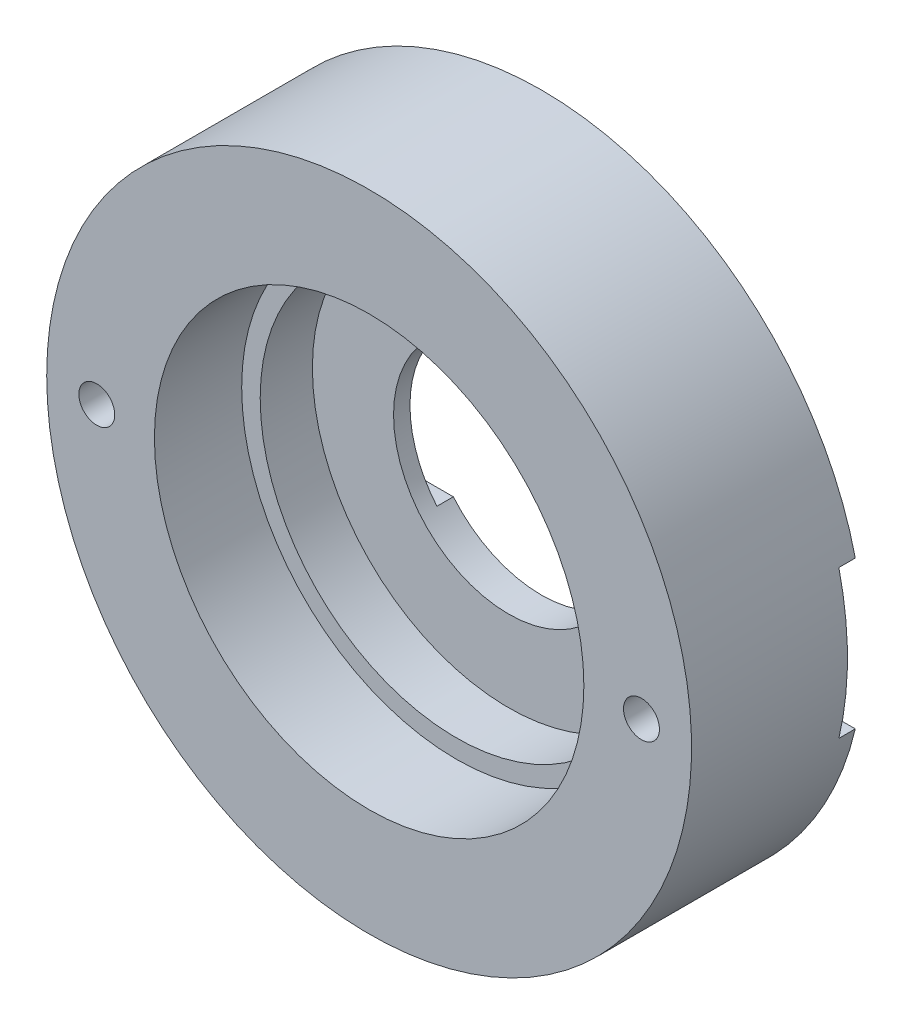
from build123d import *

# Parameters (mm, degrees)
SKETCH1_W          = 12.617819502
SKETCH1_H          = 2
SKETCH1_W_2        = 6.5532
SKETCH1_H_2        = 5.31
SKETCH2_R          = 1.0922
CUT_EXTRUDE1_DEPTH = 30.658943154
SKETCH3_W          = 45.123892984
SKETCH3_H          = 9
CUT_EXTRUDE2_DEPTH = 1


with BuildPart() as part:
    # Sketch1 → Revolve1 (revolve)
    with BuildSketch(Plane(origin=(0, 0, 0), x_dir=(1, 0, 0), z_dir=(0, 1, 0))):
        with Locations((-13.308909751, 3.700473465)):
            Rectangle(SKETCH1_W, SKETCH1_H)
        Polygon((-11.938, 2.700473465), (-19.617819502, 2.700473465), (-19.617819502, -0.474526535), (-13.064619502, -0.474526535), (-11.938, -0.474526535), align=None)
        with Locations((-16.341219502, -3.129526535)):
            Rectangle(SKETCH1_W_2, SKETCH1_H_2)
    revolve(axis=Axis((0, 0, -25.411285606), (0, 0, 1)))

    # Sketch2 → Cut-Extrude1 (cut, through all)
    with BuildSketch(Plane(origin=(0, 0, -4.700473465), x_dir=(-1, 0, 0), z_dir=(0, 0, -1))):
        with Locations((16.57, 0)):
            Circle(SKETCH2_R)
        with Locations(Location((-16.57, 0, 0), (0, 0, 180))):
            Circle(SKETCH2_R)
    extrude(amount=-CUT_EXTRUDE1_DEPTH, mode=Mode.SUBTRACT)

    # Sketch3 → Cut-Extrude2 (cut)
    with BuildSketch(Plane(origin=(0, 0, -4.700473465), x_dir=(-1, 0, 0), z_dir=(0, 0, -1))):
        Rectangle(SKETCH3_W, SKETCH3_H)
    extrude(amount=-CUT_EXTRUDE2_DEPTH, mode=Mode.SUBTRACT)


solid = part.part
